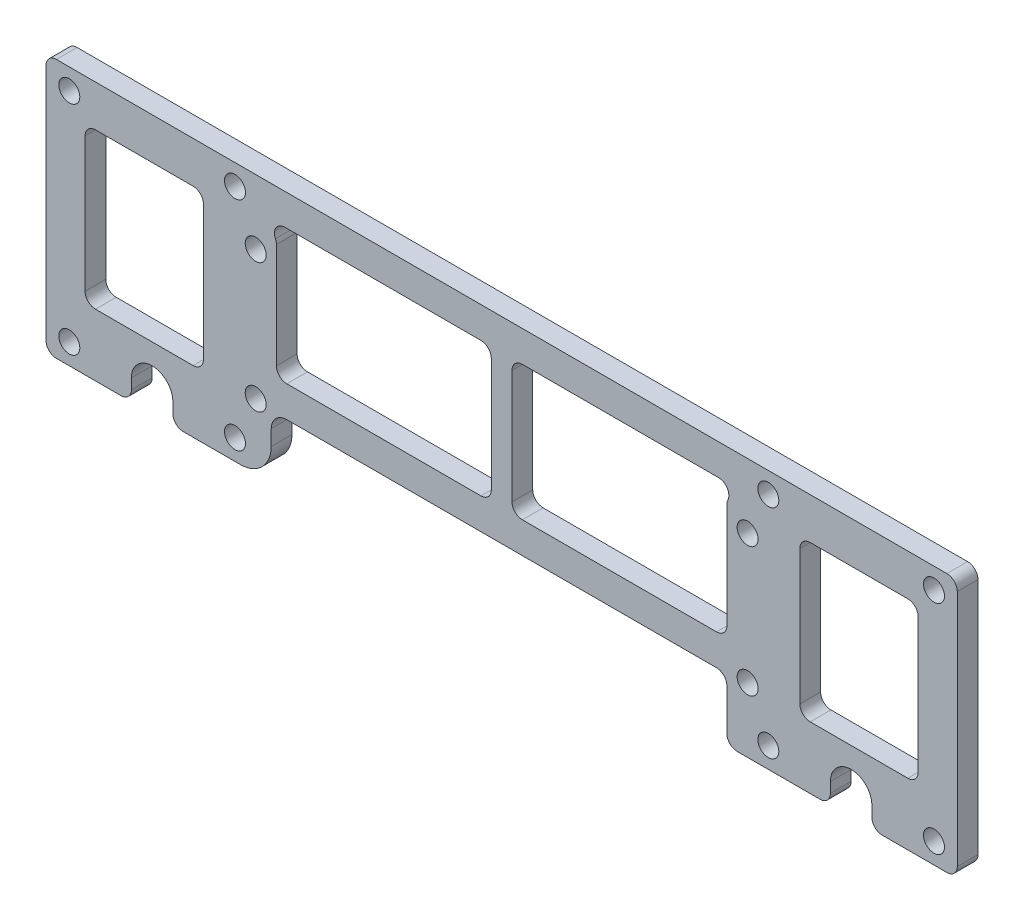
from build123d import *

# Parameters (mm, degrees)
SKETCH_1_W           = 176
SKETCH_1_H           = 50
EXTRUDE_1_DEPTH      = 2
SKETCH_2_R           = 2.025
CUT_EXTRUDE_1_DEPTH  = 22
CUT_EXTRUDE_2_DEPTH  = 17
FILLET_1_R           = 2
SKETCH_4_R           = 2.025
CUT_EXTRUDE_3_DEPTH  = 5
CUT_EXTRUDE_5_DEPTH  = 15.5
SKETCH_8_W           = 22.857142857
SKETCH_8_H           = 30
CUT_EXTRUDE_6_DEPTH  = 15.5
FILLET_2_R           = 2
SKETCH_22_W          = 54
SKETCH_22_H          = 23
CUT_EXTRUDE_14_DEPTH = 10
EXTRUDE_8_DEPTH      = 4
CHAMFER_1_SIZE       = 10
CHAMFER_2_SIZE       = 10
FILLET_9_R           = 2
SKETCH_24_W          = 87
SKETCH_24_H          = 30
CUT_EXTRUDE_15_DEPTH = 10
SKETCH_25_W          = 4
SKETCH_25_H          = 12
EXTRUDE_9_DEPTH      = 4
FILLET_10_R          = 2
CUT_EXTRUDE_16_DEPTH = 10


with BuildPart() as part:
    # 草图1 → 凸台-拉伸1 (new, symmetric)
    with BuildSketch(Plane.XY):
        Rectangle(SKETCH_1_W, SKETCH_1_H)
    extrude(amount=EXTRUDE_1_DEPTH, both=True)

    # 草图2 → 切除-拉伸1 (cut, symmetric)
    with BuildSketch(Plane(origin=(0, 0, -2), x_dir=(-1, 0, 0), z_dir=(0, 0, -1))):
        with Locations((51.5, 21)):
            Circle(SKETCH_2_R)
        with Locations((51.5, -21)):
            Circle(SKETCH_2_R)
        with Locations((83.5, 21)):
            Circle(SKETCH_2_R)
        with Locations((83.5, -21)):
            Circle(SKETCH_2_R)
    cut_extrude_1 = extrude(amount=CUT_EXTRUDE_1_DEPTH, both=True, mode=Mode.SUBTRACT)

    # 镜向1: 切除-拉伸1 across plane
    add(cut_extrude_1.mirror(Plane(origin=(0, 0, 0), x_dir=(0, 0, 1), z_dir=(1, 0, 0))), mode=Mode.SUBTRACT)

    # 草图3 → 切除-拉伸2 (cut, symmetric)
    with BuildSketch(Plane(origin=(0, 0, -2), x_dir=(-1, 0, 0), z_dir=(0, 0, -1))):
        with BuildLine():
            Line((63.5, -21), (63.5, -25))
            Line((63.5, -25), (71.5, -25))
            Line((71.5, -25), (71.5, -21))
            ThreePointArc((71.5, -21), (67.5, -17), (63.5, -21))
        make_face()
    cut_extrude_2 = extrude(amount=CUT_EXTRUDE_2_DEPTH, both=True, mode=Mode.SUBTRACT)

    # 镜向2: 切除-拉伸2 across plane
    add(cut_extrude_2.mirror(Plane(origin=(0, 0, 0), x_dir=(0, 0, 1), z_dir=(1, 0, 0))), mode=Mode.SUBTRACT)

    # 圆角1
    fillet_1_edges = [part.edges().sort_by_distance(p)[0] for p in [
        (-71.5, -25, 0),
        (-63.5, -25, 0),
        (88, -25, 0),
        (-88, -25, 0),
        (-88, 25, 0),
        (88, 25, 0),
        (63.5, -25, 0),
        (71.5, -25, 0),
    ]]
    fillet(fillet_1_edges, radius=FILLET_1_R)

    # 草图4 → 切除-拉伸3 (cut, symmetric)
    with BuildSketch(Plane(origin=(0, 0, -2), x_dir=(-1, 0, 0), z_dir=(0, 0, -1))):
        with Locations((47.5, -12.5)):
            Circle(SKETCH_4_R)
        with Locations((47.5, 12.5)):
            Circle(SKETCH_4_R)
        with Locations((-47.5, 12.5)):
            Circle(SKETCH_4_R)
        with Locations((-47.5, -12.5)):
            Circle(SKETCH_4_R)
    extrude(amount=CUT_EXTRUDE_3_DEPTH, both=True, mode=Mode.SUBTRACT)

    # 草图7 → 切除-拉伸5 (cut, symmetric)
    with BuildSketch(Plane.XY.offset(2)):
        Polygon((-2, 19), (-45.032854639, 19), (-43.5, 15.742683893), (-43.5, -15.742683893), (-45.032854639, -19), (-2, -19), align=None)
        Polygon((45.032854639, 19), (2, 19), (2, -19), (45.032854639, -19), (43.5, -15.742683893), (43.5, 15.742683893), align=None)
    extrude(amount=CUT_EXTRUDE_5_DEPTH, both=True, mode=Mode.SUBTRACT)

    # 草图8 → 切除-拉伸6 (cut, symmetric)
    with BuildSketch(Plane.XY.offset(2)):
        with Locations((-69.023809524, 2)):
            Rectangle(SKETCH_8_W, SKETCH_8_H)
        with Locations((69.023809524, 2)):
            Rectangle(SKETCH_8_W, SKETCH_8_H)
    extrude(amount=CUT_EXTRUDE_6_DEPTH, both=True, mode=Mode.SUBTRACT)

    # 圆角2
    fillet_2_edges = [part.edges().sort_by_distance(p)[0] for p in [
        (-2, 19, 0),
        (-2, -19, 0),
        (-45.032854639, -19, 0),
        (-43.5, -15.742683893, 0),
        (-43.5, 15.742683893, 0),
        (-45.032854639, 19, 0),
        (2, 19, 0),
        (45.032854639, 19, 0),
        (43.5, 15.742683893, 0),
        (43.5, -15.742683893, 0),
        (45.032854639, -19, 0),
        (2, -19, 0),
        (-80.452380952, -13, 0),
        (-80.452380952, 17, 0),
        (-57.595238095, 17, 0),
        (-57.595238095, -13, 0),
        (80.452380952, 17, 0),
        (80.452380952, -13, 0),
        (57.595238095, -13, 0),
        (57.595238095, 17, 0),
    ]]
    fillet(fillet_2_edges, radius=FILLET_2_R)

    # 草图22 → 切除-拉伸14 (cut)
    with BuildSketch(Plane(origin=(0, 0, -2), x_dir=(-1, 0, 0), z_dir=(0, 0, -1))):
        with Locations((0, -13.5)):
            Rectangle(SKETCH_22_W, SKETCH_22_H)
    extrude(amount=-CUT_EXTRUDE_14_DEPTH, mode=Mode.SUBTRACT)

    # 草图23 → 凸台-拉伸8 (add)
    with BuildSketch(Plane(origin=(0, 0, -2), x_dir=(-1, 0, 0), z_dir=(0, 0, -1))):
        Polygon((-31, -25), (-27, -25), (-27, -2), (27, -2), (27, -25), (31, -25), (31, 2), (-31, 2), align=None)
    extrude(amount=-EXTRUDE_8_DEPTH)

    # 倒角1
    chamfer_1_edges = [part.edges().sort_by_distance(p)[0] for p in [
        (27, -2, 0),
        (-27, -2, 0),
    ]]
    chamfer(chamfer_1_edges, length=CHAMFER_1_SIZE)

    # 倒角2
    chamfer_2_edges = [part.edges().sort_by_distance(p)[0] for p in [
        (31, 2, 0),
        (-31, 2, 0),
    ]]
    chamfer(chamfer_2_edges, length=CHAMFER_2_SIZE)

    # 圆角9
    fillet_9_edges = [part.edges().sort_by_distance(p)[0] for p in [
        (-27, -25, 0),
        (27, -25, 0),
        (-31, -19, 0),
        (-2, 2, 0),
        (31, -19, 0),
        (2, 2, 0),
        (21, 2, 0),
        (31, -8, 0),
        (-31, -8, 0),
        (-21, 2, 0),
    ]]
    fillet(fillet_9_edges, radius=FILLET_9_R)

    # 草图24 → 切除-拉伸15 (cut)
    with BuildSketch(Plane.XY.offset(2)):
        with Locations((0, -10)):
            Rectangle(SKETCH_24_W, SKETCH_24_H)
    extrude(amount=-CUT_EXTRUDE_15_DEPTH, mode=Mode.SUBTRACT)

    # 草图25 → 凸台-拉伸9 (add)
    with BuildSketch(Plane.XY.offset(2)):
        Polygon((2, -7), (-2, -7), (-43.5, -7), (-43.5, -13), (43.5, -13), (43.5, -7), align=None)
        with Locations((0, -1)):
            Rectangle(SKETCH_25_W, SKETCH_25_H)
        with BuildLine():
            Line((-43.5, -18.174640335), (-43.5, -15.295610336))
            ThreePointArc((-43.5, -15.295610336), (-43.548170754, -15.731915957), (-43.690362596, -16.147204408))
            Line((-43.690362596, -16.147204408), (-43.690928016, -16.148405927))
            ThreePointArc((-43.690928016, -16.148405927), (-43.872470388, -17.187624889), (-43.5, -18.174640335))
        make_face()
        with BuildLine():
            ThreePointArc((43.690362596, -16.147204408), (43.548170754, -15.731915957), (43.5, -15.295610336))
            Line((43.5, -15.295610336), (43.5, -18.174640335))
            ThreePointArc((43.5, -18.174640335), (43.872470388, -17.187624889), (43.690928016, -16.148405927))
            Line((43.690928016, -16.148405927), (43.690362596, -16.147204408))
        make_face()
    extrude(amount=-EXTRUDE_9_DEPTH)

    # 圆角10
    fillet_10_edges = [part.edges().sort_by_distance(p)[0] for p in [
        (-43.5, -25, 0),
        (43.5, -25, 0),
        (43.5, -7, 0),
        (43.5, -13, 0),
        (-43.5, -13, 0),
        (-43.5, -7, 0),
        (-2, -7, 0),
        (2, -7, 0),
    ]]
    fillet(fillet_10_edges, radius=FILLET_10_R)

    # 草图26 → 切除-拉伸16 (cut)
    with BuildSketch(Plane(origin=(0, 0, -2), x_dir=(-1, 0, 0), z_dir=(0, 0, -1))):
        with BuildLine():
            Line((44.5, -19), (44.5, -16))
            ThreePointArc((44.5, -16), (43.621320344, -13.878679656), (41.5, -13))
            ThreePointArc((41.5, -13), (42.914213562, -13.585786438), (43.5, -15))
            Line((43.5, -15), (43.5, -23))
            ThreePointArc((43.5, -23), (44.085786438, -24.414213562), (45.5, -25))
            Line((45.5, -25), (50.5, -25))
            ThreePointArc((50.5, -25), (46.257359313, -23.242640687), (44.5, -19))
        make_face()
    extrude(amount=-CUT_EXTRUDE_16_DEPTH, mode=Mode.SUBTRACT)


solid = part.part
